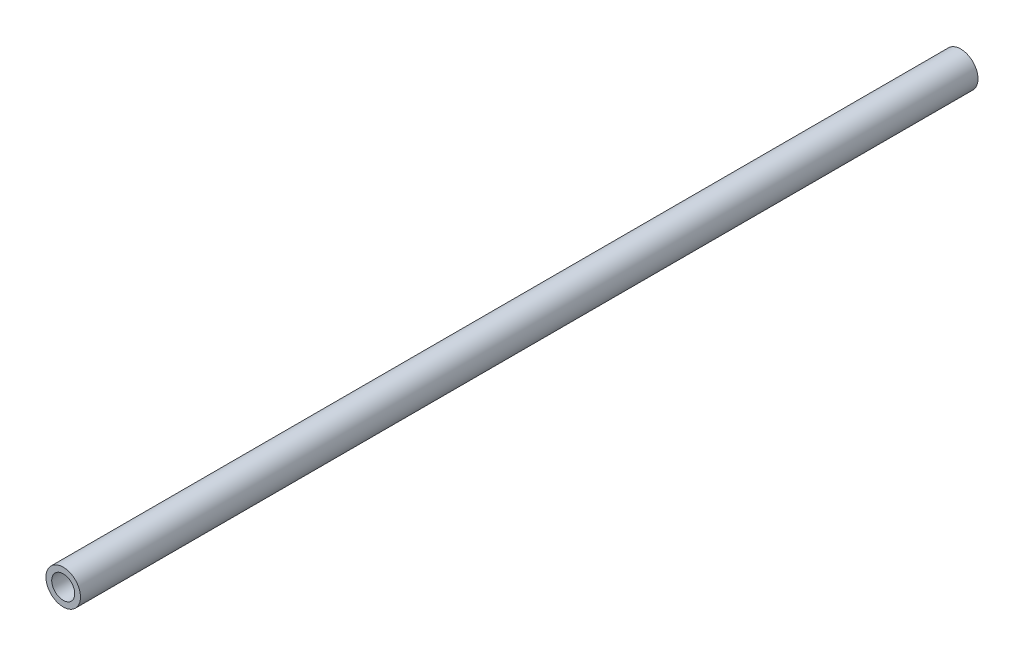
from build123d import *

# Parameters (mm, degrees)
SKETCH1_R           = 4.7625
SKETCH1_R_2         = 3.175
BOSS_EXTRUDE1_DEPTH = 123.825


with BuildPart() as part:
    # Sketch1 → Boss-Extrude1 (new, symmetric)
    with BuildSketch(Plane.XY):
        Circle(SKETCH1_R)
        Circle(SKETCH1_R_2, mode=Mode.SUBTRACT)
    extrude(amount=BOSS_EXTRUDE1_DEPTH, both=True)


solid = part.part
